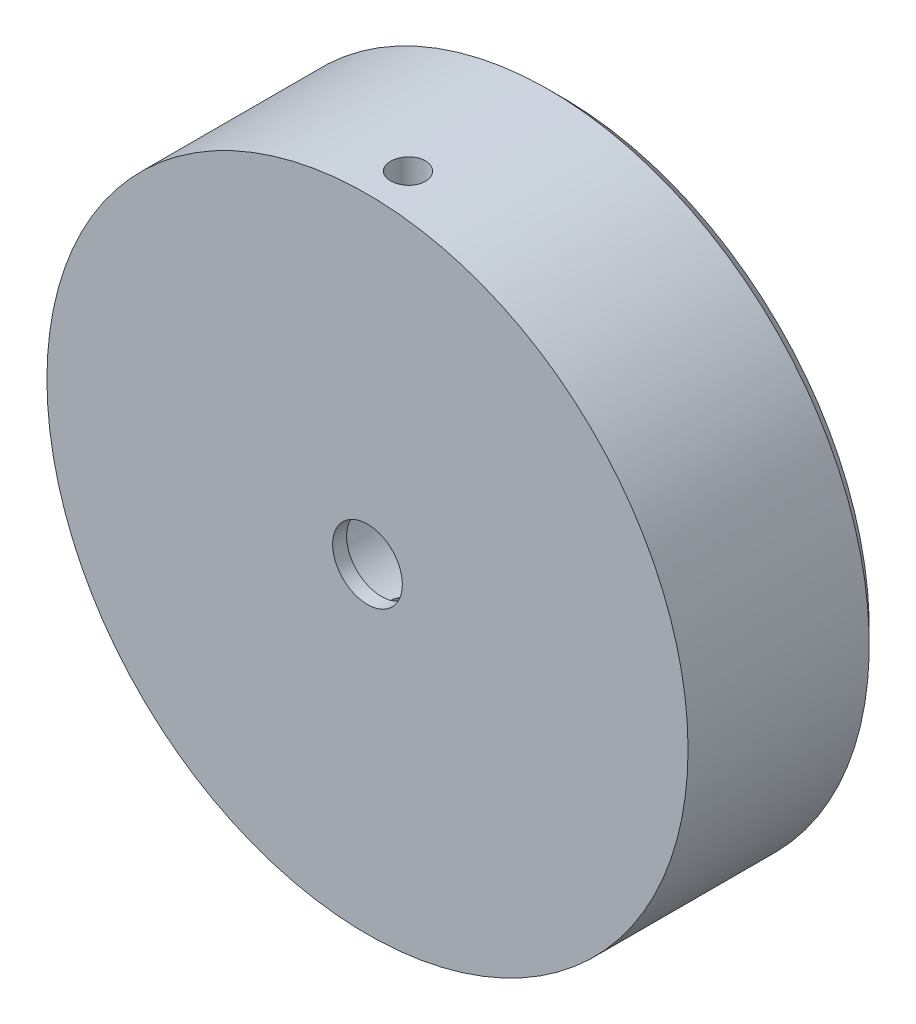
from build123d import *

# Parameters (mm, degrees)
ESBO_O1_R                  = 23
ESBO_O1_R_2                = 13.905
RESSALTO_EXTRUS_O1_DEPTH   = 11
ESBO_O2_R                  = 23
RESSALTO_EXTRUS_O2_DEPTH   = 5
ESBO_O3_R                  = 2.5
CORTE_EXTRUS_O1_DEPTH      = 18
ESBO_O4_R                  = 4.5
CORTE_EXTRUS_O2_DEPTH      = 4
ESBO_O6_R                  = 24.343049023
CORTE_EXTRUS_O4_DEPTH      = 2
CHANFRO1_SIZE              = 1
CORTE_EXTRUS_O5_DEPTH      = 30
CORTE_EXTRUS_O5_DEPTH_BACK = 31
ESBO_O7_R                  = 1.25


with BuildPart() as part:
    # Esboço1 → Ressalto-extrusão1 (new body)
    with BuildSketch(Plane.XY):
        Circle(ESBO_O1_R)
        Circle(ESBO_O1_R_2, mode=Mode.SUBTRACT)
    extrude(amount=RESSALTO_EXTRUS_O1_DEPTH)

    # Esboço2 → Ressalto-extrusão2 (add)
    with BuildSketch(Plane.XY.offset(11)):
        Circle(ESBO_O2_R)
    extrude(amount=RESSALTO_EXTRUS_O2_DEPTH)

    # Esboço3 → Corte-extrusão1 (cut)
    with BuildSketch(Plane.XY.offset(16)):
        Circle(ESBO_O3_R)
    extrude(amount=-CORTE_EXTRUS_O1_DEPTH, mode=Mode.SUBTRACT)

    # Esboço4 → Corte-extrusão2 (cut)
    with BuildSketch(Plane(origin=(0, 0, 11), x_dir=(-1, 0, 0), z_dir=(0, 0, -1))):
        Circle(ESBO_O4_R)
    extrude(amount=-CORTE_EXTRUS_O2_DEPTH, mode=Mode.SUBTRACT)

    # Esboço6 → Corte-extrusão4 (cut)
    with BuildSketch(Plane(origin=(0, 0, 0), x_dir=(-1, 0, 0), z_dir=(0, 0, -1))):
        Circle(ESBO_O6_R)
    extrude(amount=-CORTE_EXTRUS_O4_DEPTH, mode=Mode.SUBTRACT)

    # Chanfro1
    chanfro1_edges = [part.edges().sort_by_distance(p)[0] for p in [
        (-23, 0, 2),
    ]]
    chamfer(chanfro1_edges, length=CHANFRO1_SIZE)

    # Esboço7 → Corte-extrusão5 (cut, two sides: drawn at the far end of the back side and taken through both)
    with BuildSketch(Plane(origin=(0, 0, 0), x_dir=(1, 0, 0), z_dir=(0, 1, 0)).offset(-CORTE_EXTRUS_O5_DEPTH_BACK)):
        with Locations(Location((0, -13.09796997, 0), (0, 0, 90))):
            Circle(ESBO_O7_R)
    extrude(amount=CORTE_EXTRUS_O5_DEPTH + CORTE_EXTRUS_O5_DEPTH_BACK, mode=Mode.SUBTRACT)


solid = part.part
